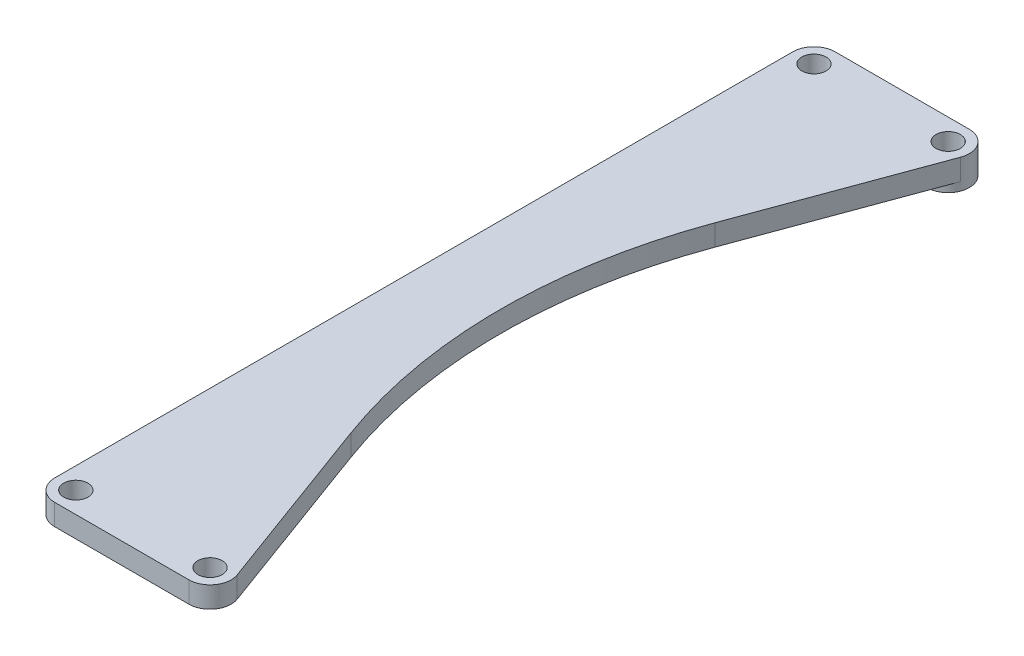
from build123d import *

# Parameters (mm, degrees)
SKETCH1_R           = 2.3
BOSS_EXTRUDE2_DEPTH = 4
FILLET1_R           = 4
FILLET2_R           = 100
BOSS_EXTRUDE3_START = -5.575308
SKETCH2_R           = 2.3
BOSS_EXTRUDE3_DEPTH = 1.575308


with BuildPart() as part:
    # Sketch1 → Boss-Extrude2 (new body)
    with BuildSketch(Plane(origin=(0, 0, 0), x_dir=(1, 0, 0), z_dir=(0, 1, 0))):
        with BuildLine():
            Line((-4, -143.7), (-4, 4))
            Line((-4, 4), (25.4, 4))
            ThreePointArc((25.4, 4), (28.6800532, 2.289377864), (29.154640594, -1.379374498))
            Line((29.154640594, -1.379374498), (4, -69.85))
            Line((4, -69.85), (29.154640594, -138.320625502))
            ThreePointArc((29.154640594, -138.320625502), (28.6800532, -141.989377864), (25.4, -143.7))
            Line((25.4, -143.7), (-4, -143.7))
        make_face()
        with Locations(Location((0, 0, 0), (0, 0, 270))):
            Circle(SKETCH1_R, mode=Mode.SUBTRACT)
        with Locations(Location((25.4, 0, 0), (0, 0, 270))):
            Circle(SKETCH1_R, mode=Mode.SUBTRACT)
        with Locations(Location((25.4, -139.7, 0), (0, 0, 270))):
            Circle(SKETCH1_R, mode=Mode.SUBTRACT)
        with Locations(Location((0, -139.7, 0), (0, 0, 270))):
            Circle(SKETCH1_R, mode=Mode.SUBTRACT)
    extrude(amount=BOSS_EXTRUDE2_DEPTH)

    # Fillet1
    fillet1_edges = [part.edges().sort_by_distance(p)[0] for p in [
        (-4, 2, 143.7),
        (-4, 2, -4),
    ]]
    fillet(fillet1_edges, radius=FILLET1_R)

    # Fillet2
    fillet2_edges = [part.edges().sort_by_distance(p)[0] for p in [
        (4, 2, 69.85),
    ]]
    fillet(fillet2_edges, radius=FILLET2_R)

    # Sketch2 → Boss-Extrude3 (add)
    with BuildSketch(Plane(origin=(0, 4, 0), x_dir=(1, 0, 0), z_dir=(0, 1, 0)).offset(BOSS_EXTRUDE3_START)):
        with BuildLine():
            Line((0, -4), (25.4, -4))
            ThreePointArc((25.4, -4), (29.4, 0), (25.4, 4))
            Line((25.4, 4), (0, 4))
            ThreePointArc((0, 4), (-4, 0), (0, -4))
        make_face()
        with Locations(Location((0, 0, 0), (0, 0, 270))):
            Circle(SKETCH2_R, mode=Mode.SUBTRACT)
        with Locations(Location((25.4, 0, 0), (0, 0, 270))):
            Circle(SKETCH2_R, mode=Mode.SUBTRACT)
    extrude(amount=BOSS_EXTRUDE3_DEPTH)


solid = part.part
